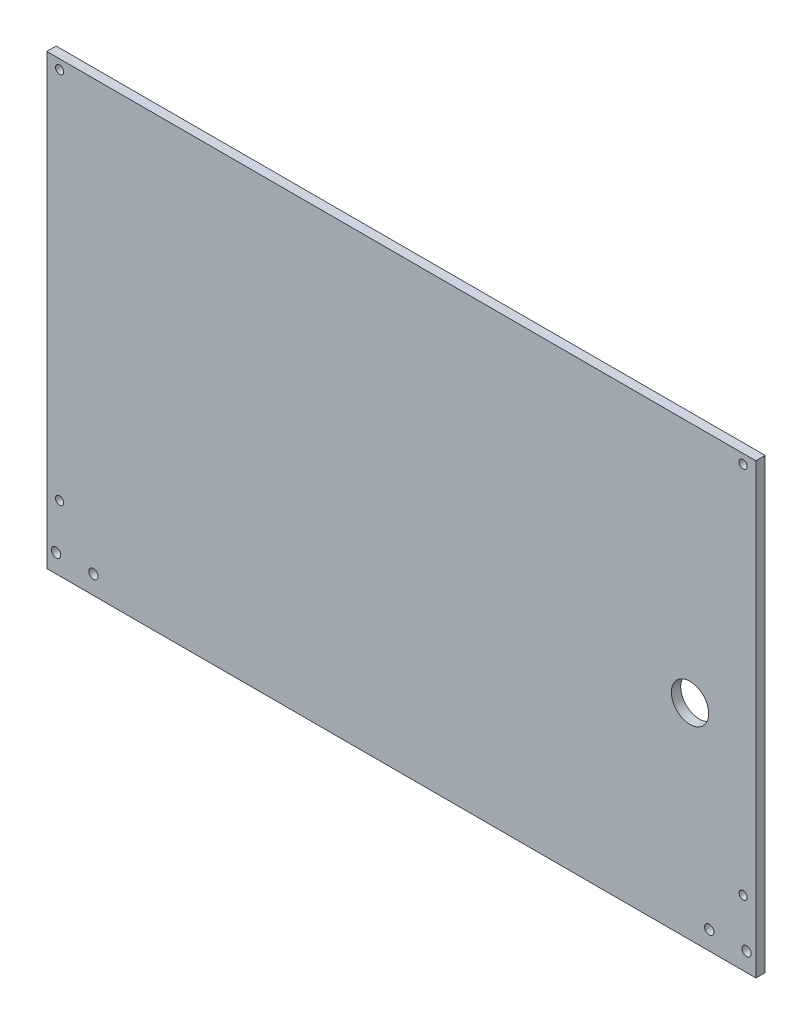
from build123d import *

# Parameters (mm, degrees)
SKETCH1_W           = 482.6
SKETCH1_H           = 304.8
BOSS_EXTRUDE1_DEPTH = 6.35
SKETCH2_R           = 2.7813
CUT_EXTRUDE1_DEPTH  = 286.467638271
SKETCH3_R           = 3.175
CUT_EXTRUDE2_DEPTH  = 286.467638271
SKETCH4_R           = 12.7
CUT_EXTRUDE3_DEPTH  = 286.467638271


with BuildPart() as part:
    # Sketch1 → Boss-Extrude1 (new body)
    with BuildSketch(Plane.XY):
        Rectangle(SKETCH1_W, SKETCH1_H)
    extrude(amount=BOSS_EXTRUDE1_DEPTH)

    # Sketch2 → Cut-Extrude1 (cut, through all)
    with BuildSketch(Plane.XY.offset(6.35)):
        with Locations((-232.5624, 146.05)):
            Circle(SKETCH2_R)
        with Locations((-232.5624, -107.95)):
            Circle(SKETCH2_R)
    cut_extrude1 = extrude(amount=-CUT_EXTRUDE1_DEPTH, mode=Mode.SUBTRACT)

    # Mirror1: Cut-Extrude1 across plane
    add(cut_extrude1.mirror(Plane(origin=(0, 0, 0), x_dir=(0, 0, 1), z_dir=(1, 0, 0))), mode=Mode.SUBTRACT)

    # Sketch3 → Cut-Extrude2 (cut, through all)
    with BuildSketch(Plane.XY.offset(6.35)):
        with Locations((-234.95, -139.7)):
            Circle(SKETCH3_R)
        with Locations((-209.55, -139.7)):
            Circle(SKETCH3_R)
    cut_extrude2 = extrude(amount=-CUT_EXTRUDE2_DEPTH, mode=Mode.SUBTRACT)

    # Mirror2: Cut-Extrude2 across plane
    add(cut_extrude2.mirror(Plane(origin=(0, 0, 0), x_dir=(0, 0, 1), z_dir=(1, 0, 0))), mode=Mode.SUBTRACT)

    # Sketch4 → Cut-Extrude3 (cut, through all)
    with BuildSketch(Plane.XY.offset(6.35)):
        with Locations((196.469, -12.7)):
            Circle(SKETCH4_R)
    extrude(amount=-CUT_EXTRUDE3_DEPTH, mode=Mode.SUBTRACT)


solid = part.part
